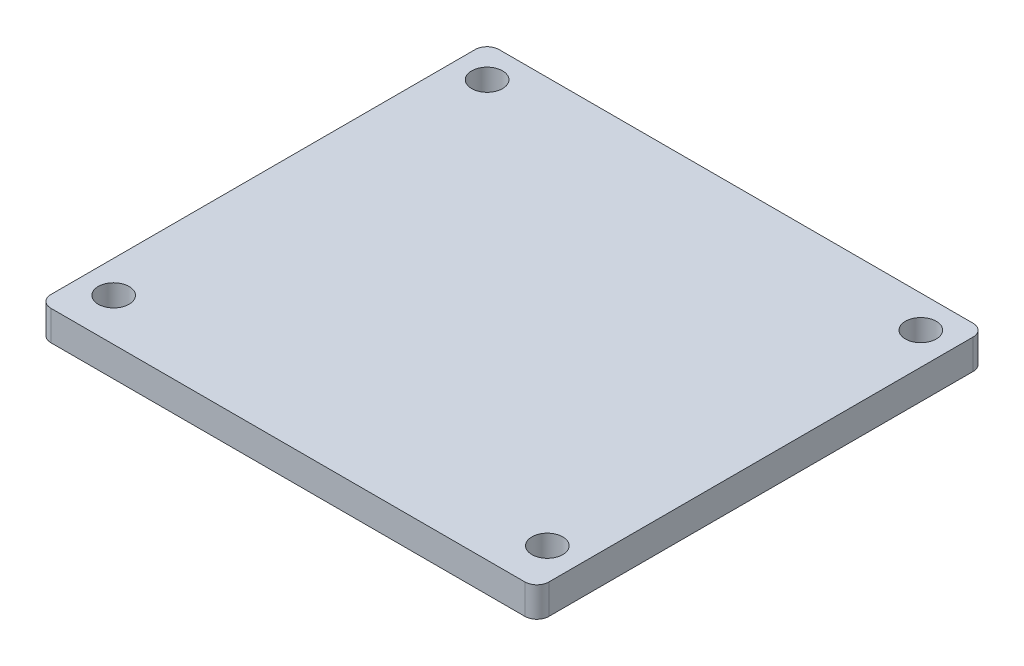
from build123d import *

# Parameters (mm, degrees)
SKETCH_1_R      = 1.55
EXTRUDE_1_DEPTH = 3


with BuildPart() as part:
    # 草圖1 → 填料-伸長1 (new body)
    with BuildSketch(Plane(origin=(0, 0, 0), x_dir=(1, 0, 0), z_dir=(0, 1, 0))):
        with BuildLine():
            Line((-23.8, -22.5), (23.8, -22.5))
            ThreePointArc((23.8, -22.5), (24.648528137, -22.148528137), (25, -21.3))
            Line((25, -21.3), (25, 21.3))
            ThreePointArc((25, 21.3), (24.648528137, 22.148528137), (23.8, 22.5))
            Line((23.8, 22.5), (-23.8, 22.5))
            ThreePointArc((-23.8, 22.5), (-24.648528137, 22.148528137), (-25, 21.3))
            Line((-25, 21.3), (-25, -21.3))
            ThreePointArc((-25, -21.3), (-24.648528137, -22.148528137), (-23.8, -22.5))
        make_face()
        with Locations(Location((-21.775, 19.275, 0), (0, 0, 270))):
            Circle(SKETCH_1_R, mode=Mode.SUBTRACT)
        with Locations(Location((21.775, 19.275, 0), (0, 0, 270))):
            Circle(SKETCH_1_R, mode=Mode.SUBTRACT)
        with Locations(Location((21.775, -18.225, 0), (0, 0, 270))):
            Circle(SKETCH_1_R, mode=Mode.SUBTRACT)
        with Locations(Location((-21.775, -18.225, 0), (0, 0, 270))):
            Circle(SKETCH_1_R, mode=Mode.SUBTRACT)
    extrude(amount=EXTRUDE_1_DEPTH)


solid = part.part
